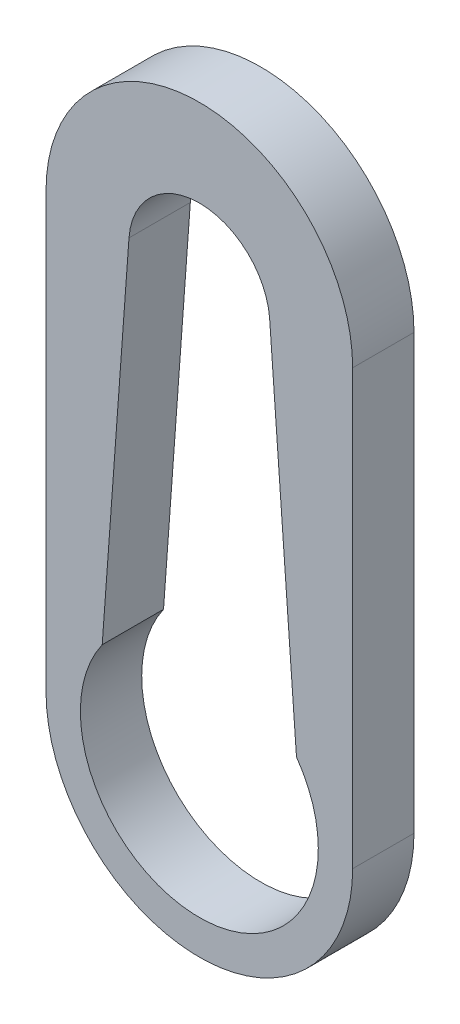
from build123d import *

# Parameters (mm, degrees)
BOSS_EXTRUDE1_DEPTH = 2


with BuildPart() as part:
    # Sketch1 → Boss-Extrude1 (new body)
    with BuildSketch(Plane.XY):
        with BuildLine():
            Line((75.585447554, 59.931475915), (75.585447554, 74.077647485))
            ThreePointArc((75.585447554, 74.077647485), (80.585447554, 79.077647485), (85.585447554, 74.077647485))
            Line((85.585447554, 74.077647485), (85.585447554, 59.931475915))
            ThreePointArc((85.585447554, 59.931475915), (80.585447554, 54.931475915), (75.585447554, 59.931475915))
        make_face()
        with BuildLine():
            Line((78.291593741, 74.09957403), (77.417478776, 62.171649257))
            ThreePointArc((77.417478776, 62.171649257), (80.585447576, 56.052944097), (83.753416376, 62.171649257))
            Line((83.753416376, 62.171649257), (82.879285937, 74.099576949))
            ThreePointArc((82.879285937, 74.099576949), (80.585438483, 76.231471338), (78.291593741, 74.09957403))
        make_face(mode=Mode.SUBTRACT)
    extrude(amount=BOSS_EXTRUDE1_DEPTH)


solid = part.part
